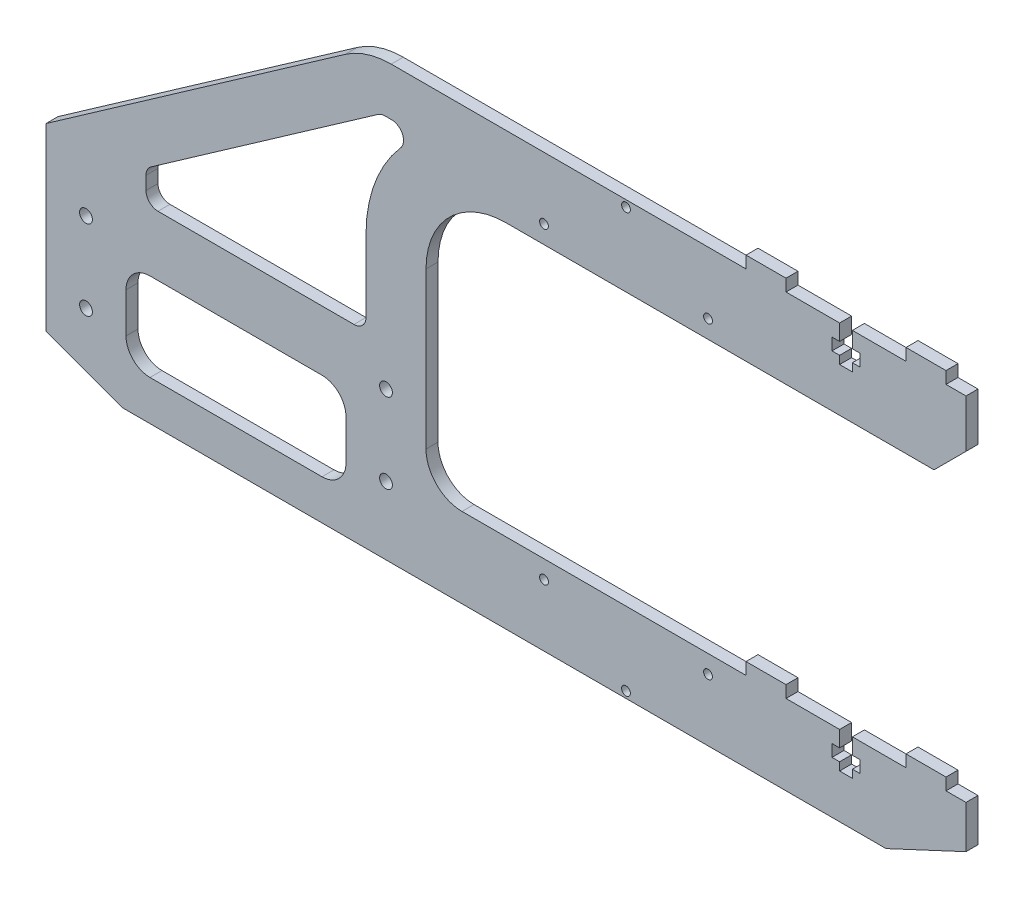
from build123d import *

# Parameters (mm, degrees)
SKETCH_1_R          = 1.6
EXTRUDE_1_DEPTH     = 3
SKETCH_4_W          = 10
SKETCH_4_H          = 3
EXTRUDE_2_DEPTH     = 3
SKETCH_5_R          = 1.1
CUT_EXTRUDE_1_DEPTH = 200.90049168
FILLET_1_R          = 20
FILLET_2_R          = 9
SKETCH_6_W          = 55
SKETCH_6_H          = 21.983396943
CUT_EXTRUDE_2_DEPTH = 200.90049168
FILLET_3_R          = 6
FILLET_4_R          = 3
FILLET_5_R          = 20
CHAMFER_1_SIZE      = 8
CHAMFER_3_SIZE      = 20
CHAMFER_3_SIZE2     = 9.326153163


with BuildPart() as part:
    # 草图1 → 凸台-拉伸1 (new body)
    with BuildSketch(Plane.XY):
        Polygon((-47.5, -22.5), (-47.5, 22.5), (32.5, 78.516603057), (182.5, 78.516603057), (182.5, 58.516603057), (47.5, 58.516603057), (47.5, -9.483396943), (182.5, -9.483396943), (182.5, -29.483396943), (-28.313274587, -29.483396943), align=None)
        with Locations((-37.5, 7.5)):
            Circle(SKETCH_1_R, mode=Mode.SUBTRACT)
        with Locations((-37.5, -12.5)):
            Circle(SKETCH_1_R, mode=Mode.SUBTRACT)
        with Locations((37.5, 7.5)):
            Circle(SKETCH_1_R, mode=Mode.SUBTRACT)
        with Locations((37.5, -12.5)):
            Circle(SKETCH_1_R, mode=Mode.SUBTRACT)
    extrude(amount=EXTRUDE_1_DEPTH)

    # 草图4 → 凸台-拉伸2 (add)
    with BuildSketch(Plane.XY.offset(3)):
        with Locations((132.5, 80.016603057)):
            Rectangle(SKETCH_4_W, SKETCH_4_H)
        with Locations((172.5, 80.016603057)):
            Rectangle(SKETCH_4_W, SKETCH_4_H)
        with Locations((132.5, -7.983396943)):
            Rectangle(SKETCH_4_W, SKETCH_4_H)
        with Locations((172.5, -7.983396943)):
            Rectangle(SKETCH_4_W, SKETCH_4_H)
    extrude(amount=-EXTRUDE_2_DEPTH)

    # 草图5 → 切除-拉伸1 (cut, through all)
    with BuildSketch(Plane.XY.offset(3)):
        with Locations((77, -13.983396943)):
            Circle(SKETCH_5_R)
        with Locations((118, -13.983396943)):
            Circle(SKETCH_5_R)
        with Locations((97.5, -27.833396943)):
            Circle(SKETCH_5_R)
        with Locations((77, 63.016603057)):
            Circle(SKETCH_5_R)
        with Locations((118, 63.016603057)):
            Circle(SKETCH_5_R)
        with Locations((97.5, 76.866603057)):
            Circle(SKETCH_5_R)
        Polygon((150.9, 78.516603057), (154.1, 78.516603057), (154.1, 74.516603057), (156, 74.516603057), (156, 71.516603057), (154.1, 71.516603057), (154.1, 69.516603057), (150.9, 69.516603057), (150.9, 71.516603057), (149, 71.516603057), (149, 74.516603057), (150.9, 74.516603057), align=None)
        Polygon((150.9, -9.483396943), (154.1, -9.483396943), (154.1, -13.483396943), (156, -13.483396943), (156, -16.483396943), (154.1, -16.483396943), (154.1, -18.483396943), (150.9, -18.483396943), (150.9, -16.483396943), (149, -16.483396943), (149, -13.483396943), (150.9, -13.483396943), align=None)
    extrude(amount=-CUT_EXTRUDE_1_DEPTH, mode=Mode.SUBTRACT)

    # 圆角1
    fillet_1_edges = [part.edges().sort_by_distance(p)[0] for p in [
        (47.5, 58.516603057, 1.5),
    ]]
    fillet(fillet_1_edges, radius=FILLET_1_R)

    # 圆角2
    fillet_2_edges = [part.edges().sort_by_distance(p)[0] for p in [
        (47.5, -9.483396943, 1.5),
    ]]
    fillet(fillet_2_edges, radius=FILLET_2_R)

    # 草图6 → 切除-拉伸2 (cut, through all)
    with BuildSketch(Plane.XY.offset(3)):
        with BuildLine():
            Line((-22.5, 25.35589339), (36.283585467, 66.516603057))
            Line((36.283585467, 66.516603057), (46.5, 66.516603057))
            ThreePointArc((46.5, 66.516603057), (36.195048315, 54.169078899), (32.5, 38.516603057))
            Line((32.5, 38.516603057), (32.5, 17.5))
            Line((32.5, 17.5), (-22.5, 17.5))
            Line((-22.5, 17.5), (-22.5, 25.35589339))
        make_face()
        with Locations((0, -8.491698472)):
            Rectangle(SKETCH_6_W, SKETCH_6_H)
    extrude(amount=-CUT_EXTRUDE_2_DEPTH, mode=Mode.SUBTRACT)

    # 圆角3
    fillet_3_edges = [part.edges().sort_by_distance(p)[0] for p in [
        (27.5, 2.5, 1.5),
        (27.5, -19.483396943, 1.5),
        (-27.5, -19.483396943, 1.5),
        (-27.5, 2.5, 1.5),
    ]]
    fillet(fillet_3_edges, radius=FILLET_3_R)

    # 圆角4
    fillet_4_edges = [part.edges().sort_by_distance(p)[0] for p in [
        (-22.5, 17.5, 1.5),
        (-22.5, 25.35589339, 1.5),
        (36.283585467, 66.516603057, 1.5),
        (46.5, 66.516603057, 1.5),
        (32.5, 17.5, 1.5),
    ]]
    fillet(fillet_4_edges, radius=FILLET_4_R)

    # 圆角5
    fillet_5_edges = [part.edges().sort_by_distance(p)[0] for p in [
        (32.5, 78.516603057, 1.5),
    ]]
    fillet(fillet_5_edges, radius=FILLET_5_R)

    # 倒角1
    chamfer_1_edges = [part.edges().sort_by_distance(p)[0] for p in [
        (182.5, 58.516603057, 1.5),
    ]]
    chamfer(chamfer_1_edges, length=CHAMFER_1_SIZE)

    # 倒角3
    chamfer_3_edges = [part.edges().sort_by_distance(p)[0] for p in [
        (182.5, -29.483396943, 1.5),
    ]]
    chamfer_3_side = [part.faces().sort_by_distance(p)[0] for p in [
        (77.093362706, -29.483396943, 1.5),
    ]]
    chamfer(chamfer_3_edges, length=CHAMFER_3_SIZE, length2=CHAMFER_3_SIZE2, reference=chamfer_3_side[0])


solid = part.part
